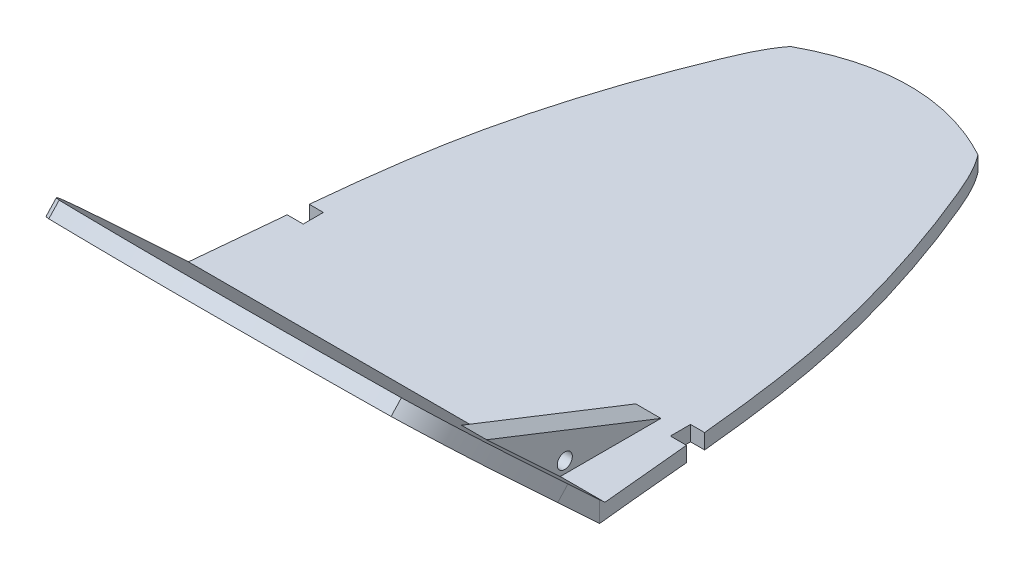
from build123d import *

# Parameters (mm, degrees)
BOSS_EXTRUDE3_DEPTH      = 48.5
BOSS_EXTRUDE3_DEPTH_BACK = 48.5
SKETCH5_W                = 97
SKETCH5_H                = 112
BOSS_EXTRUDE4_DEPTH      = 3
CUT_EXTRUDE2_DEPTH       = 130.256547379
CUT_EXTRUDE2_DEPTH_BACK  = 130.256547379
CUT_EXTRUDE4_DEPTH       = 3
BOSS_EXTRUDE5_DEPTH      = 2.5
BOSS_EXTRUDE5_DEPTH_BACK = 2.5
BOSS_EXTRUDE5_START      = 30
CUT_EXTRUDE5_REACH       = 139.837
SKETCH7_R                = 1.5
CUT_EXTRUDE6_DEPTH       = 122.615440307
CUT_EXTRUDE6_DEPTH_BACK  = 122.615440307
CUT_EXTRUDE7_DEPTH       = 122.12407756
CUT_EXTRUDE7_DEPTH_BACK  = 122.12407756
CUT_EXTRUDE8_DEPTH       = 117.339027133
CUT_EXTRUDE8_DEPTH_BACK  = 117.339027133
SKETCH10_W               = 6
SKETCH10_H               = 4


with BuildPart() as part:
    # Sketch2 → Boss-Extrude3 (new, two sides: drawn at the far end of the back side and taken through both)
    with BuildSketch(Plane(origin=(0, 0, 0), x_dir=(0, 0, -1), z_dir=(1, 0, 0)).offset(-BOSS_EXTRUDE3_DEPTH_BACK)):
        Polygon((0, 3), (0, 0), (-43.282778347, 40.361843779), (-41.236783267, 42.555904884), (1.181731427, 3), align=None)
    extrude(amount=BOSS_EXTRUDE3_DEPTH + BOSS_EXTRUDE3_DEPTH_BACK)

    # Sketch5 → Boss-Extrude4 (add)
    with BuildSketch(Plane(origin=(0, 0, 0), x_dir=(1, 0, 0), z_dir=(0, 1, 0))):
        with Locations((0, 56)):
            Rectangle(SKETCH5_W, SKETCH5_H)
    extrude(amount=BOSS_EXTRUDE4_DEPTH)

    # Sketch1 → Cut-Extrude2 (cut, two sides: drawn at the far end of the back side and taken through both)
    with BuildSketch(Plane(origin=(0, 0, 0), x_dir=(1, 0, 0), z_dir=(0, 1, 0)).offset(-CUT_EXTRUDE2_DEPTH_BACK)):
        with BuildLine():
            Line((-48.5, 112), (-48.5, 0))
            add(Edge.make_bspline(
                [(-48.5, 0), (-46.668219381, 16.73988075), (-45.240302981, 47.028669482), (-35.05303198, 77.976446005), (-30, 90)],
                knots=[0, 0, 0, 0, 0.382344481, 0.700509355, 0.700509355, 0.700509355, 0.700509355], degree=3))
            add(Edge.make_bspline(
                [(-30, 90), (0, 116.175267558), (30, 90)],
                knots=[0, 0, 0, 1, 1, 1], degree=2))
            add(Edge.make_bspline(
                [(48.5, 0), (46.668219381, 16.73988075), (45.240302981, 47.028669482), (35.05303198, 77.976446005), (30, 90)],
                knots=[0, 0, 0, 0, 0.382344481, 0.700509355, 0.700509355, 0.700509355, 0.700509355], degree=3))
            Line((48.5, 0), (48.5, 112))
            Line((48.5, 112), (0.000604535, 112))
            add(Edge.make_bspline(
                [(0.000604535, 112), (0.000402118, 112.000000335), (0.000200606, 112), (0, 112)],
                knots=[0.499749242, 0.499749242, 0.499749242, 0.499749242, 0.5, 0.5, 0.5, 0.5], degree=3))
            add(Edge.make_bspline(
                [(-0.000604535, 112), (-0.000402118, 112.000000335), (-0.000200606, 112), (0, 112)],
                knots=[0.499749242, 0.499749242, 0.499749242, 0.499749242, 0.5, 0.5, 0.5, 0.5], degree=3))
            Line((-0.000604535, 112), (-48.5, 112))
        make_face()
    extrude(amount=CUT_EXTRUDE2_DEPTH + CUT_EXTRUDE2_DEPTH_BACK, mode=Mode.SUBTRACT)

    # Sketch3 → Cut-Extrude4 (cut)
    with BuildSketch(Plane(origin=(0, 2.194061105, -2.04599508), x_dir=(1, 0, 0), z_dir=(0, 0.7313537016191954, -0.6819983600624717))):
        with BuildLine():
            add(Edge.make_bspline(
                [(0.003253746, -59.181731489), (0.002169164, -59.181731447), (0.001084582, -59.181731427), (-11.666666667, -59.181731427), (-23.333333333, -58.181731427), (-35, -56.181731427)],
                knots=[0.5, 0.5, 0.5, 0.5, 0.500017125, 0.500017125, 0.68423249, 0.68423249, 0.68423249, 0.68423249], degree=3))
            add(Edge.make_bspline(
                [(-48.5, -21.181731427), (-48.417358315, -22.852595783), (-47.967318833, -26.18014585), (-47.488346612, -31.180984412), (-47.077284528, -36.21090256), (-46.163364333, -41.331987069), (-44.016260247, -46.352305403), (-40.960990685, -51.961105588), (-37.244446824, -54.910271793), (-35, -56.181731427)],
                knots=[0.083959733, 0.083959733, 0.083959733, 0.083959733, 0.112085896, 0.140212058, 0.168338221, 0.196879042, 0.227021509, 0.259659186, 0.303375618, 0.303375618, 0.303375618, 0.303375618], degree=3))
            Line((-48.5, -21.181731427), (-48.5, -61.181731427))
            Line((-48.5, -61.181731427), (48.5, -61.181731427))
            Line((48.5, -61.181731427), (48.5, -21.181731427))
            add(Edge.make_bspline(
                [(35, -56.181731427), (37.244446825, -54.910271793), (40.960990685, -51.961105588), (44.016260247, -46.352305403), (46.163364333, -41.331987069), (47.077284528, -36.21090256), (47.488346612, -31.180984412), (47.967318833, -26.18014585), (48.417358315, -22.852595783), (48.5, -21.181731427)],
                knots=[0.696624382, 0.696624382, 0.696624382, 0.696624382, 0.740340814, 0.772978491, 0.803120958, 0.831661779, 0.859787942, 0.887914104, 0.916040267, 0.916040267, 0.916040267, 0.916040267], degree=3))
            add(Edge.make_bspline(
                [(0.003253746, -59.181731401), (17.501626873, -59.181452534), (35, -56.181731427)],
                knots=[0.500046482, 0.500046482, 0.500046482, 1, 1, 1], degree=2))
        make_face()
    extrude(amount=-CUT_EXTRUDE4_DEPTH, mode=Mode.SUBTRACT)

    # Sketch6 → Boss-Extrude5 (add, two sides: drawn at the far end of the back side and taken through both)
    with BuildSketch(Plane(origin=(0, 0, 0), x_dir=(0, 0, -1), z_dir=(1, 0, 0)).offset(BOSS_EXTRUDE5_START - BOSS_EXTRUDE5_DEPTH_BACK)):
        Polygon((-13.445342606, 16.639967201), (1.181731427, 3), (21.181731427, 3), align=None)
    extrude(amount=BOSS_EXTRUDE5_DEPTH + BOSS_EXTRUDE5_DEPTH_BACK)

    # Sketch7 → Cut-Extrude5 (cut, up to next)
    with BuildSketch(Plane(origin=(32.5, 0, 0), x_dir=(0, 0, -1), z_dir=(1, 0, 0)), mode=Mode.PRIVATE) as cut_extrude5_sk1:
        with Locations((2.081159003, 5.275894374)):
            Circle(SKETCH7_R)
    cut_extrude5_tool1 = extrude(cut_extrude5_sk1.sketch, amount=-CUT_EXTRUDE5_REACH, mode=Mode.PRIVATE) & part.part
    add(cut_extrude5_tool1.solids().sort_by_distance((32.5, 5.275894, -2.081159))[0], mode=Mode.SUBTRACT)

    # Sketch8 → Cut-Extrude6 (cut, two sides: drawn at the far end of the back side and taken through both)
    with BuildSketch(Plane(origin=(0, 0, 0), x_dir=(1, 0, 0), z_dir=(0, 1, 0)).offset(-CUT_EXTRUDE6_DEPTH_BACK)):
        with BuildLine():
            Line((-54.764420155, 0), (-41.5, 0))
            add(Edge.make_bspline(
                [(-41.5, 0), (-39.668219381, 16.73988075), (-38.240302981, 47.028669482), (-26.765457272, 81.887952266), (-20.154727783, 96.534338226), (-17, 100)],
                knots=[0, 0, 0, 0, 0.382344481, 0.700509355, 0.789047112, 0.789047112, 0.789047112, 0.789047112], degree=3))
            add(Edge.make_bspline(
                [(-17, 100), (0, 120), (17, 100)],
                knots=[0, 0, 0, 1, 1, 1], degree=2))
            add(Edge.make_bspline(
                [(41.5, 0), (39.668219381, 16.73988075), (38.240302981, 47.028669482), (26.765457272, 81.887952266), (20.154727783, 96.534338226), (17, 100)],
                knots=[0, 0, 0, 0, 0.382344481, 0.700509355, 0.789047112, 0.789047112, 0.789047112, 0.789047112], degree=3))
            Line((41.5, 0), (52.945964887, 0))
            Line((52.945964887, 0), (52.945964887, 112))
            Line((52.945964887, 112), (0.000604535, 112))
            add(Edge.make_bspline(
                [(0.000604535, 112), (0.000402118, 112.000000335), (0.000200606, 112), (-0.000200606, 112), (-0.000402118, 112.000000335), (-0.000604535, 112)],
                knots=[0.499749242, 0.499749242, 0.499749242, 0.499749242, 0.5, 0.5, 0.500250758, 0.500250758, 0.500250758, 0.500250758], degree=3))
            Line((-0.000604535, 112), (-54.764420155, 112))
            Line((-54.764420155, 112), (-54.764420155, 0))
        make_face()
    extrude(amount=CUT_EXTRUDE6_DEPTH + CUT_EXTRUDE6_DEPTH_BACK, mode=Mode.SUBTRACT)

    # Sketch9 → Cut-Extrude7 (cut, two sides: drawn at the far end of the back side and taken through both)
    with BuildSketch(Plane(origin=(0, -0.88962398, -0.95400492), x_dir=(1, 0, 0), z_dir=(0, -0.7313537016191742, 0.6819983600624945)).offset(-CUT_EXTRUDE7_DEPTH_BACK)):
        with BuildLine():
            Line((-48.5, 1.304437125), (-41.5, 1.304437125))
            Line((-41.5, 1.304437125), (-41.5, 12.697506333))
            add(Edge.make_bspline(
                [(-41.5, 12.697506333), (-41.619417946, 17.695292117), (-41.882631341, 26.061036421), (-40.482582838, 38.387050164), (-37.089687463, 45.094795293), (-34, 47.697506333)],
                knots=[0.453483069, 0.453483069, 0.453483069, 0.453483069, 0.764085595, 0.973470506, 1.217568664, 1.217568664, 1.217568664, 1.217568664], degree=3))
            add(Edge.make_bspline(
                [(-34, 47.697506333), (0, 57.697506333), (34, 47.697506333)],
                knots=[0, 0, 0, 1, 1, 1], degree=2))
            add(Edge.make_bspline(
                [(34, 47.697506333), (37.089687463, 45.094795293), (40.482582838, 38.387050164), (41.882631341, 26.061036421), (41.619417946, 17.695292117), (41.5, 12.697506333)],
                knots=[0, 0, 0, 0, 0.244098157, 0.453483069, 0.764085595, 0.764085595, 0.764085595, 0.764085595], degree=3))
            Line((41.5, 12.697506333), (41.5, 1.304437125))
            Line((41.5, 1.304437125), (48.5, 1.304437125))
            Line((48.5, 1.304437125), (52.410754568, 1.304437125))
            Line((52.410754568, 1.304437125), (52.410754568, 62.418268573))
            Line((52.410754568, 62.418268573), (-55.183679752, 62.418268573))
            Line((-55.183679752, 62.418268573), (-55.183679752, 1.304437125))
            Line((-55.183679752, 1.304437125), (-48.5, 1.304437125))
        make_face()
    extrude(amount=CUT_EXTRUDE7_DEPTH + CUT_EXTRUDE7_DEPTH_BACK, mode=Mode.SUBTRACT)

    # Sketch10 → Cut-Extrude8 (cut, two sides: drawn at the far end of the back side and taken through both)
    with BuildSketch(Plane(origin=(0, 3, 0), x_dir=(1, 0, 0), z_dir=(0, 1, 0)).offset(-CUT_EXTRUDE8_DEPTH_BACK)):
        with Locations((-39.47035467, 21.087633779)):
            Rectangle(SKETCH10_W, SKETCH10_H)
        with Locations((39.47035467, 21.087633779)):
            Rectangle(SKETCH10_W, SKETCH10_H)
    extrude(amount=CUT_EXTRUDE8_DEPTH + CUT_EXTRUDE8_DEPTH_BACK, mode=Mode.SUBTRACT)


solid = part.part
